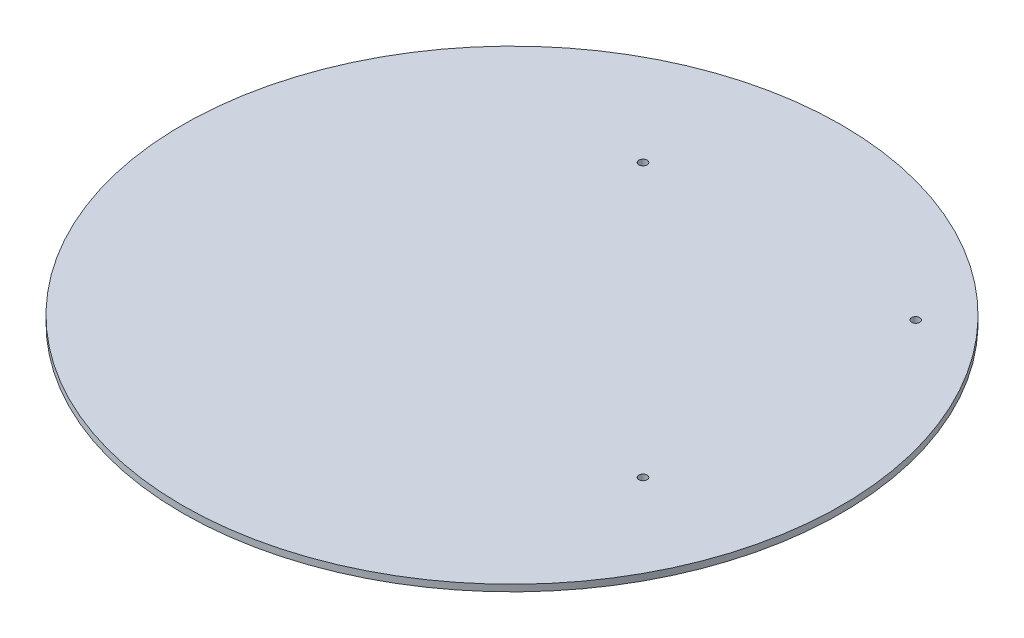
from build123d import *

# Parameters (mm, degrees)
SKETCH1_R           = 200
SKETCH1_R_2         = 2.5
BOSS_EXTRUDE1_DEPTH = 4


with BuildPart() as part:
    # Sketch1 → Boss-Extrude1 (new body)
    with BuildSketch(Plane(origin=(0, 0, 0), x_dir=(1, 0, 0), z_dir=(0, 1, 0))):
        with Locations(Location((0, 0, 0), (0, 0, 270))):
            Circle(SKETCH1_R)
        with Locations(Location((125, 120, 0), (0, 0, 270))):
            Circle(SKETCH1_R_2, mode=Mode.SUBTRACT)
        with Locations(Location((-40.5, 120, 0), (0, 0, 270))):
            Circle(SKETCH1_R_2, mode=Mode.SUBTRACT)
        with Locations(Location((125, -45.5, 0), (0, 0, 270))):
            Circle(SKETCH1_R_2, mode=Mode.SUBTRACT)
    extrude(amount=BOSS_EXTRUDE1_DEPTH)


solid = part.part
